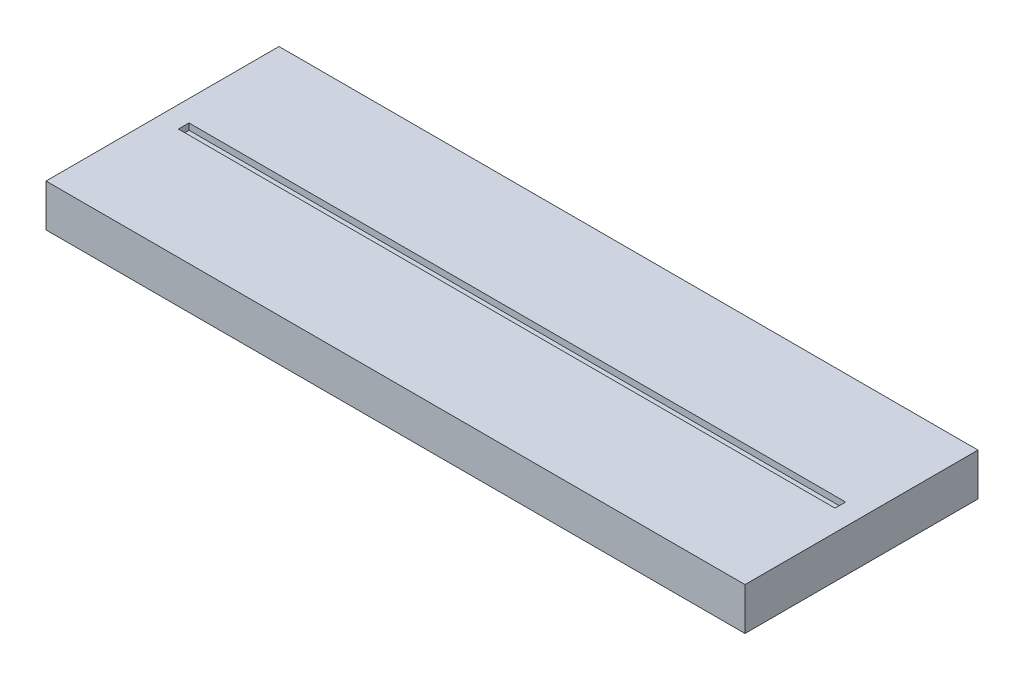
from build123d import *

# Parameters (mm, degrees)
SKETCH1_W            = 165
SKETCH1_H            = 55
BODY_DEPTH           = 10
CENTRE_CHANNEL_START = 10
SKETCH2_W            = 155
SKETCH2_H            = 2.5
CENTRE_CHANNEL_DEPTH = 1.5


with BuildPart() as part:
    # Sketch1 → Body (new body)
    with BuildSketch(Plane(origin=(0, 0, 0), x_dir=(1, 0, 0), z_dir=(0, 1, 0))):
        Rectangle(SKETCH1_W, SKETCH1_H)
    extrude(amount=BODY_DEPTH)

    # Sketch2 → Centre_Channel (cut)
    with BuildSketch(Plane(origin=(0, 0, 0), x_dir=(1, 0, 0), z_dir=(0, 1, 0)).offset(CENTRE_CHANNEL_START)):
        Rectangle(SKETCH2_W, SKETCH2_H)
    extrude(amount=-CENTRE_CHANNEL_DEPTH, mode=Mode.SUBTRACT)


solid = part.part
